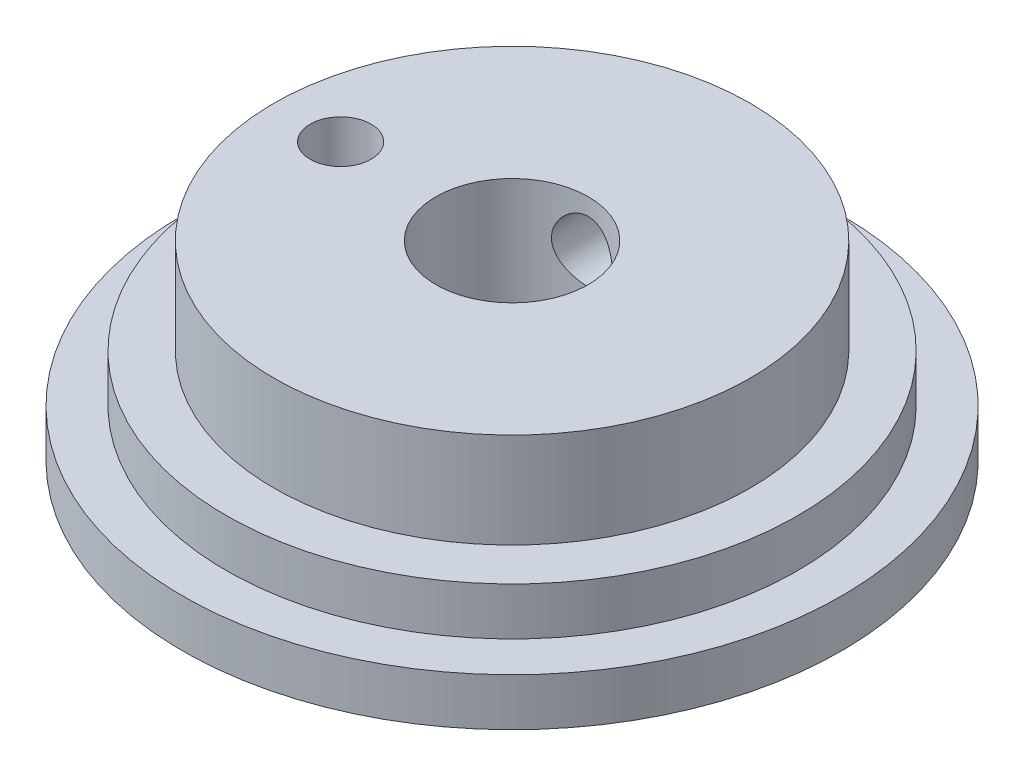
from build123d import *

# Parameters (mm, degrees)
SKETCH_1_W          = 8.5
SKETCH_1_H          = 5
SKETCH_2_R          = 1.6
CUT_EXTRUDE_1_DEPTH = 27.43066401
SKETCH_3_R          = 1.6
CUT_EXTRUDE_2_DEPTH = 27.430664048


with BuildPart() as part:
    # ｽｹｯﾁ1 → 回転2 (revolve)
    with BuildSketch(Plane.XY, mode=Mode.PRIVATE) as revolve_2_sk:
        Polygon((-4, 0), (-4, 5), (-12.5, 5), (-15, 5), (-15, 2.5), (-17.3, 2.5), (-17.3, 0), align=None)
        with Locations((-8.25, 7.5)):
            Rectangle(SKETCH_1_W, SKETCH_1_H)
    revolve(revolve_2_sk.sketch.rotate(Axis((0, 0, 0), (0, 1, 0)), 270), axis=Axis((0, 0, 0), (0, 1, 0)))

    # ｽｹｯﾁ2 → ｶｯﾄ - 押し出し1 (cut, through all)
    with BuildSketch(Plane.XY):
        with Locations(Location((0, 7.5, 0), (0, 0, 90))):
            Circle(SKETCH_2_R)
    extrude(amount=-CUT_EXTRUDE_1_DEPTH, mode=Mode.SUBTRACT)

    # ｽｹｯﾁ3 → ｶｯﾄ - 押し出し2 (cut, through all)
    with BuildSketch(Plane(origin=(0, 10, 0), x_dir=(1, 0, 0), z_dir=(0, 1, 0))):
        with Locations(Location((-9, 0, 0), (0, 0, 270))):
            Circle(SKETCH_3_R)
    extrude(amount=-CUT_EXTRUDE_2_DEPTH, mode=Mode.SUBTRACT)


solid = part.part
